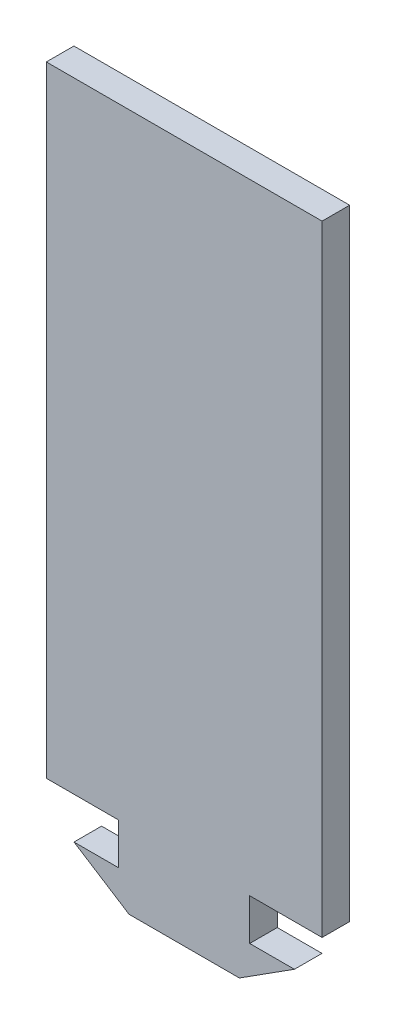
from build123d import *

# Parameters (mm, degrees)
EXTRUDE_1_DEPTH = 2


with BuildPart() as part:
    # Эскиз1 → Бобышка-Вытянуть1 (new body)
    with BuildSketch(Plane.XY):
        Polygon((-4.75, -25.5), (-7.994122029, -25.5), (-4, -28.043942726), (4, -28.043942726), (7.994122029, -25.5), (4.75, -25.5), (4.75, -22.5), (10, -22.5), (10, 22.5), (-10, 22.5), (-10, -22.5), (-4.75, -22.5), align=None)
    extrude(amount=EXTRUDE_1_DEPTH)


solid = part.part
